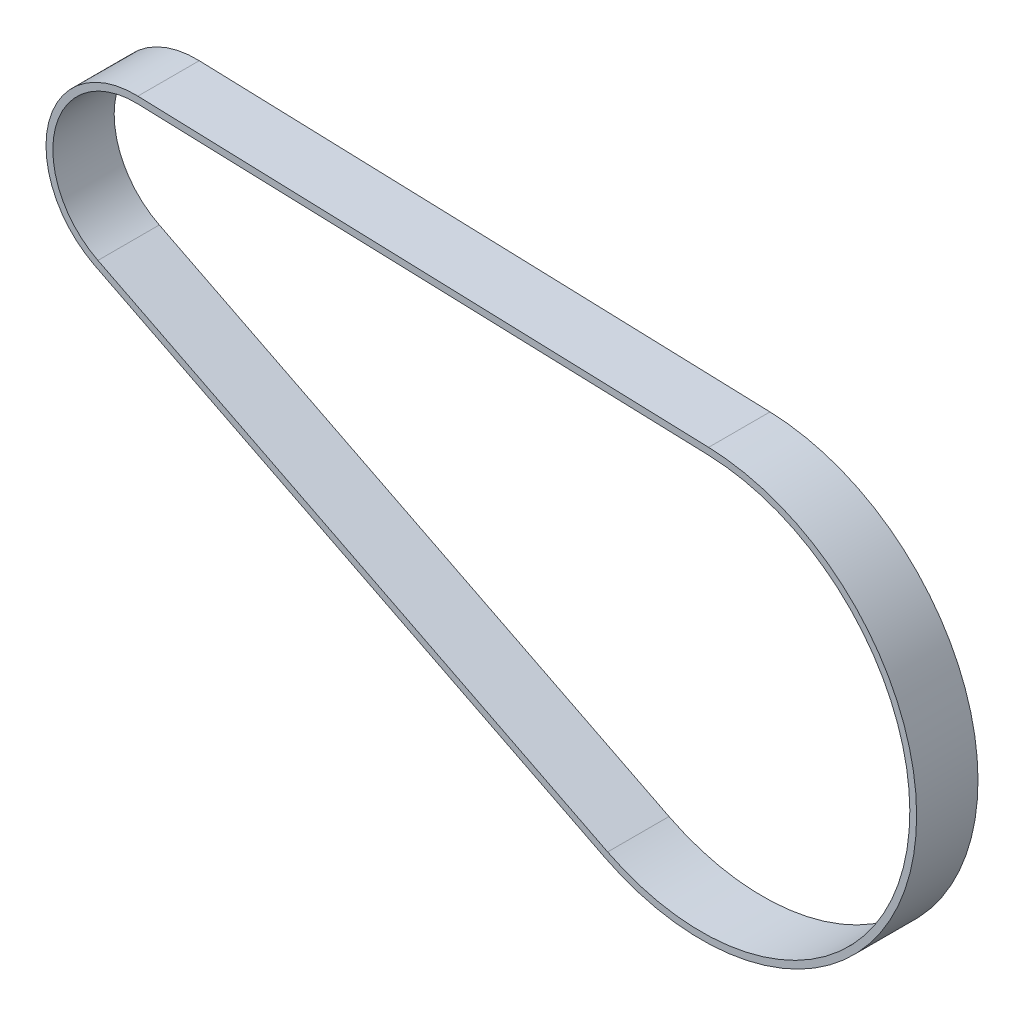
from build123d import *

# Parameters (mm, degrees)
EXTRUDE_THIN1_DEPTH      = 4.5
EXTRUDE_THIN1_DEPTH_BACK = 4.5


with BuildPart() as part:
    # Sketch2 → Extrude-Thin1 (new, two sides: drawn at the far end of the back side and taken through both)
    with BuildSketch(Plane.XY.offset(-EXTRUDE_THIN1_DEPTH_BACK)):
        with BuildLine():
            Line((-82.671493911, 34.290728623), (1.038850809, 31.532892176))
            ThreePointArc((1.038850809, 31.532892176), (30.56666476, -7.815465785), (-14.224187077, -28.161587348))
            Line((-14.224187077, -28.161587348), (-88.984731452, 9.599351197))
            ThreePointArc((-88.984731452, 9.599351197), (-95.744456769, 24.480509466), (-82.671493911, 34.290728623))
        make_face()
        with BuildLine():
            Line((-82.704421037, 33.291270868), (1.005923683, 30.533434421))
            ThreePointArc((1.005923683, 30.533434421), (29.59783228, -7.567748962), (-13.773341211, -27.268985531))
            Line((-13.773341211, -27.268985531), (-88.533885586, 10.491953014))
            ThreePointArc((-88.533885586, 10.491953014), (-94.775624289, 24.232792642), (-82.704421037, 33.291270868))
        make_face(mode=Mode.SUBTRACT)
    extrude(amount=EXTRUDE_THIN1_DEPTH + EXTRUDE_THIN1_DEPTH_BACK)


solid = part.part
